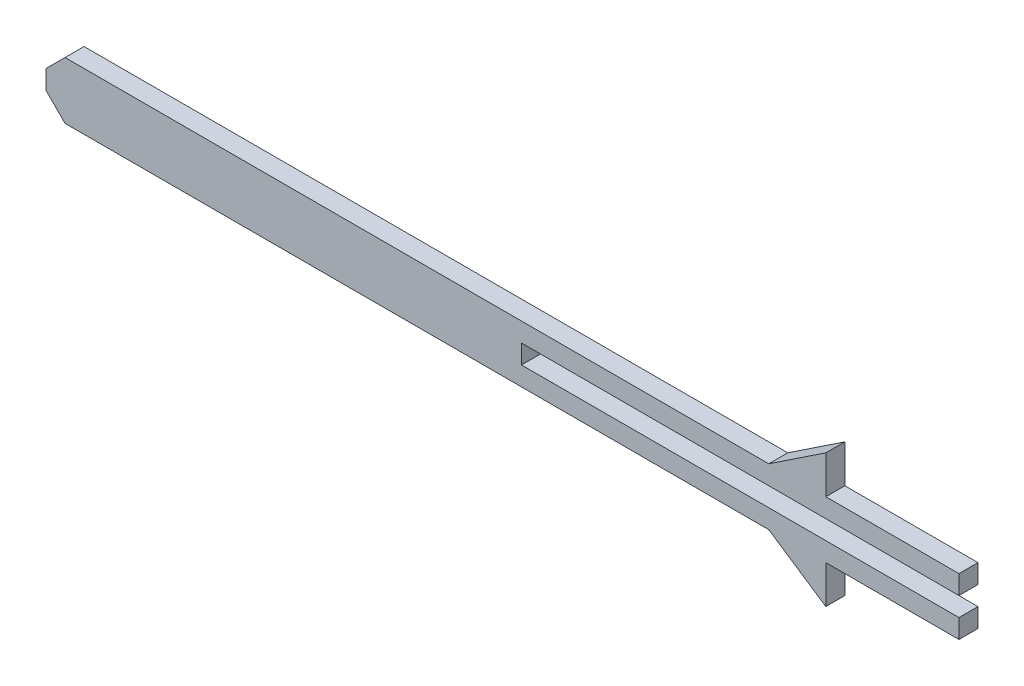
from build123d import *

# Parameters (mm, degrees)
BOSS_EXTRUDE1_DEPTH = 3


with BuildPart() as part:
    # Sketch1 → Boss-Extrude1 (new body)
    with BuildSketch(Plane.XY):
        Polygon((471.942277064, 9.51412737), (471.942277064, 3.51412737), (462.942277064, 9.51412737), (351.942277064, 9.51412737), (348.942277064, 12.51412737), (348.942277064, 15.51412737), (351.942277064, 18.51412737), (462.942277064, 18.51412737), (471.942277064, 24.51412737), (471.942277064, 18.51412737), (492.942277064, 18.51412737), (492.942277064, 15.51412737), (423.942277064, 15.51412737), (423.942277064, 12.51412737), (492.942277064, 12.51412737), (492.942277064, 9.51412737), align=None)
    extrude(amount=BOSS_EXTRUDE1_DEPTH)


solid = part.part
